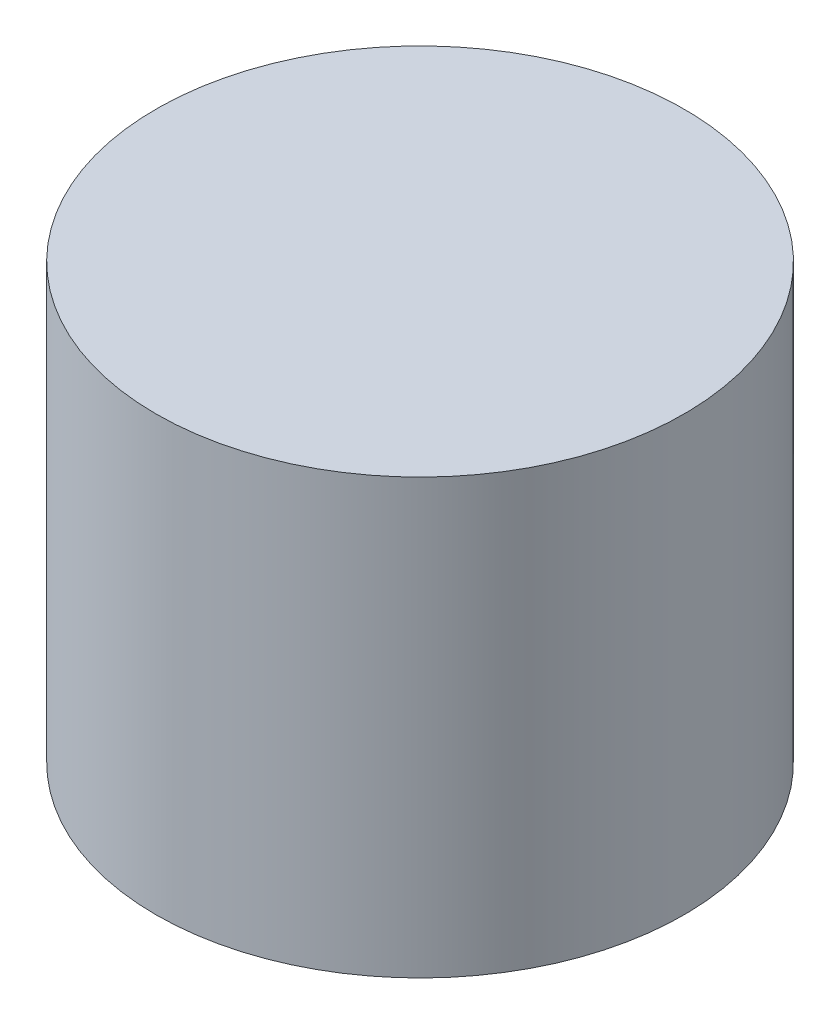
from build123d import *

# Parameters (mm, degrees)
SKETCH_1_R      = 2.8
EXTRUDE_1_DEPTH = 4.6


with BuildPart() as part:
    # Эскиз1 → Бобышка-Вытянуть1 (new body)
    with BuildSketch(Plane(origin=(0, 0, 0), x_dir=(1, 0, 0), z_dir=(0, 1, 0))):
        with Locations(Location((0, 0, 0), (0, 0, 270))):
            Circle(SKETCH_1_R)
    extrude(amount=EXTRUDE_1_DEPTH)


solid = part.part
